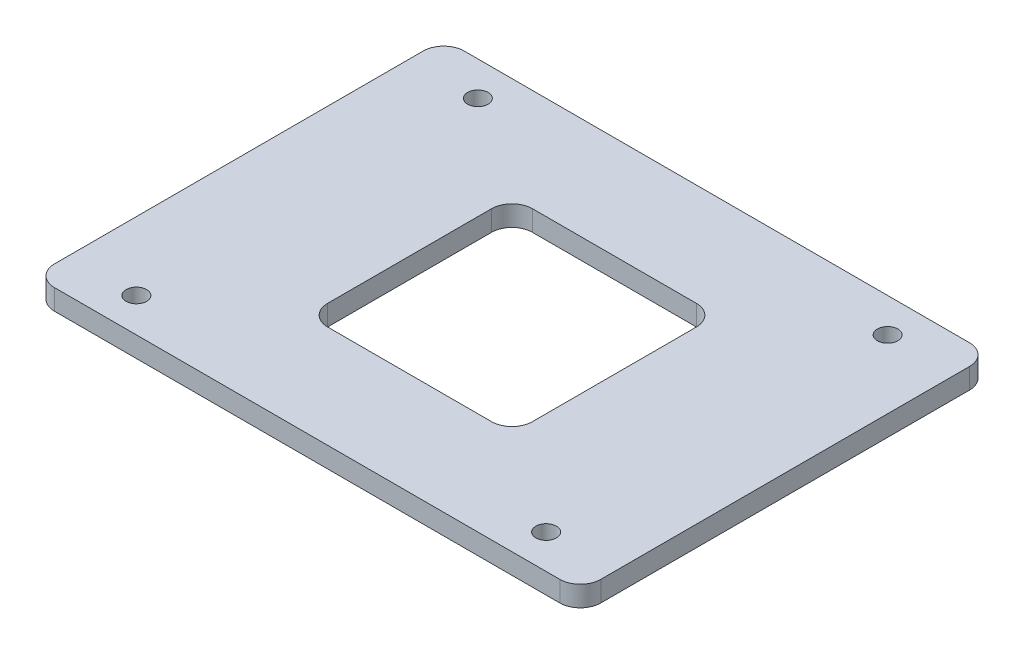
from build123d import *

# Parameters (mm, degrees)
SKETCH_1_W      = 80
SKETCH_1_H      = 60
SKETCH_1_R      = 1.5
SKETCH_1_W_2    = 30
SKETCH_1_H_2    = 30
EXTRUDE_1_DEPTH = 3
FILLET_1_R      = 3
FILLET_2_R      = 3


with BuildPart() as part:
    # 草图1 → 凸台-拉伸1 (new body)
    with BuildSketch(Plane(origin=(0, 0, 0), x_dir=(1, 0, 0), z_dir=(0, 1, 0))):
        Rectangle(SKETCH_1_W, SKETCH_1_H)
        with Locations(Location((-30, 25, 0), (0, 0, 270))):
            Circle(SKETCH_1_R, mode=Mode.SUBTRACT)
        with Locations(Location((30, 25, 0), (0, 0, 90))):
            Circle(SKETCH_1_R, mode=Mode.SUBTRACT)
        with Locations(Location((30, -25, 0), (0, 0, 270))):
            Circle(SKETCH_1_R, mode=Mode.SUBTRACT)
        with Locations(Location((-30, -25, 0), (0, 0, 90))):
            Circle(SKETCH_1_R, mode=Mode.SUBTRACT)
        Rectangle(SKETCH_1_W_2, SKETCH_1_H_2, mode=Mode.SUBTRACT)
    extrude(amount=EXTRUDE_1_DEPTH)

    # 圆角1
    fillet_1_edges = [part.edges().sort_by_distance(p)[0] for p in [
        (40, 1.5, 30),
        (-40, 1.5, 30),
        (-40, 1.5, -30),
        (40, 1.5, -30),
    ]]
    fillet(fillet_1_edges, radius=FILLET_1_R)

    # 圆角2
    fillet_2_edges = [part.edges().sort_by_distance(p)[0] for p in [
        (15, 1.5, 15),
        (15, 1.5, -15),
        (-15, 1.5, -15),
        (-15, 1.5, 15),
    ]]
    fillet(fillet_2_edges, radius=FILLET_2_R)


solid = part.part
